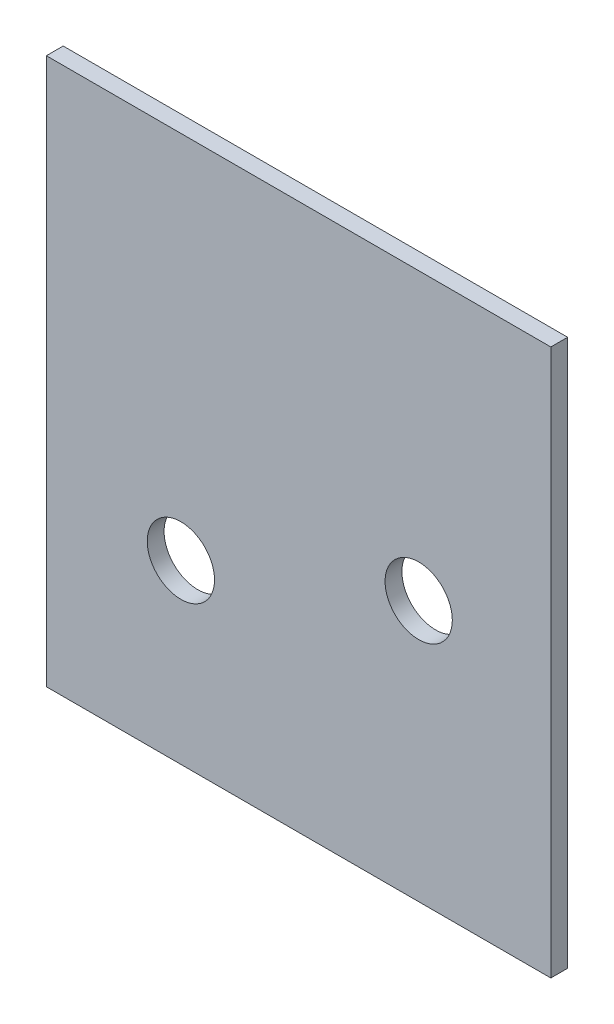
from build123d import *

# Parameters (mm, degrees)
SKETCH_1_W          = 300
SKETCH_1_H          = 300
EXTRUDE_1_DEPTH     = 10
SKETCH_2_R          = 20
CUT_EXTRUDE_1_DEPTH = 213.367605816
SKETCH_3_W          = 300
SKETCH_3_H          = 10
EXTRUDE_2_DEPTH     = 25


with BuildPart() as part:
    # 草图1 → 凸台-拉伸1 (new body)
    with BuildSketch(Plane.XY):
        Rectangle(SKETCH_1_W, SKETCH_1_H)
    extrude(amount=EXTRUDE_1_DEPTH)

    # 草图2 → 切除-拉伸1 (cut, through all)
    with BuildSketch(Plane.XY.offset(10)):
        with Locations((-70, -70)):
            Circle(SKETCH_2_R)
        with Locations((71.421356237, -20)):
            Circle(SKETCH_2_R)
    extrude(amount=-CUT_EXTRUDE_1_DEPTH, mode=Mode.SUBTRACT)

    # 草图3 → 凸台-拉伸2 (add)
    with BuildSketch(Plane.XZ.offset(150)):
        with Locations((0, 5)):
            Rectangle(SKETCH_3_W, SKETCH_3_H)
    extrude(amount=EXTRUDE_2_DEPTH)


solid = part.part
